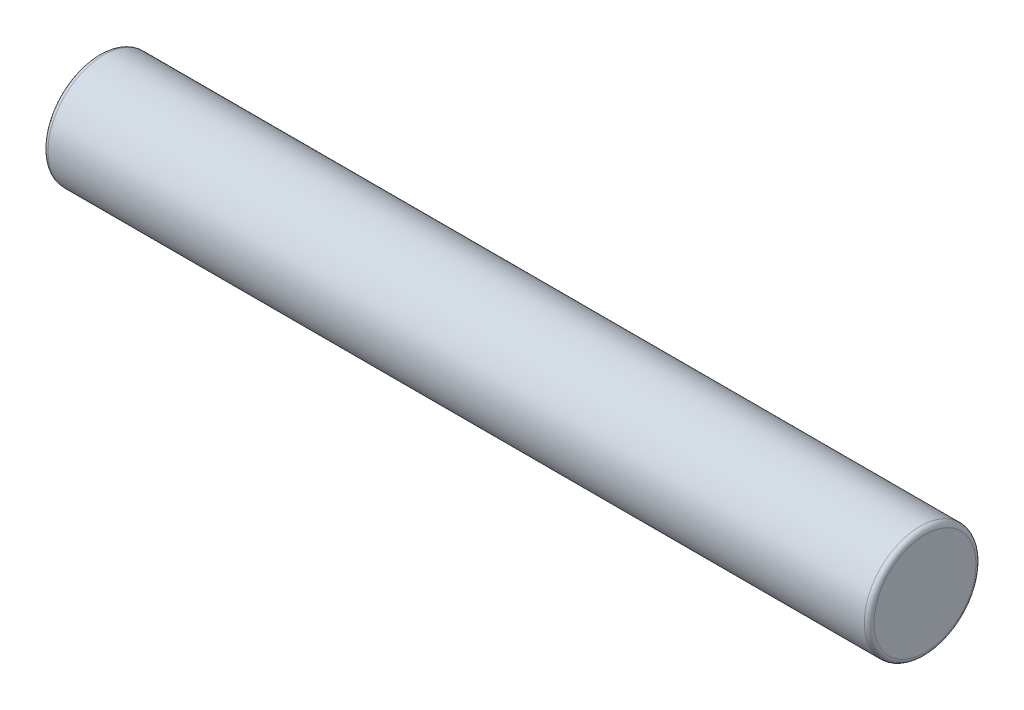
from build123d import *

# Parameters (mm, degrees)
SKETCH1_R           = 1.15
BOSS_EXTRUDE1_DEPTH = 8.5
FILLET1_R           = 0.1


with BuildPart() as part:
    # Sketch1 → Boss-Extrude1 (new, symmetric)
    with BuildSketch(Plane(origin=(0, 0, 0), x_dir=(0, 0, -1), z_dir=(1, 0, 0))):
        Circle(SKETCH1_R)
    extrude(amount=BOSS_EXTRUDE1_DEPTH, both=True)

    # Fillet1
    fillet1_edges = [part.edges().sort_by_distance(p)[0] for p in [
        (-8.5, 0, 1.15),
        (8.5, 0, 1.15),
    ]]
    fillet(fillet1_edges, radius=FILLET1_R)


solid = part.part
